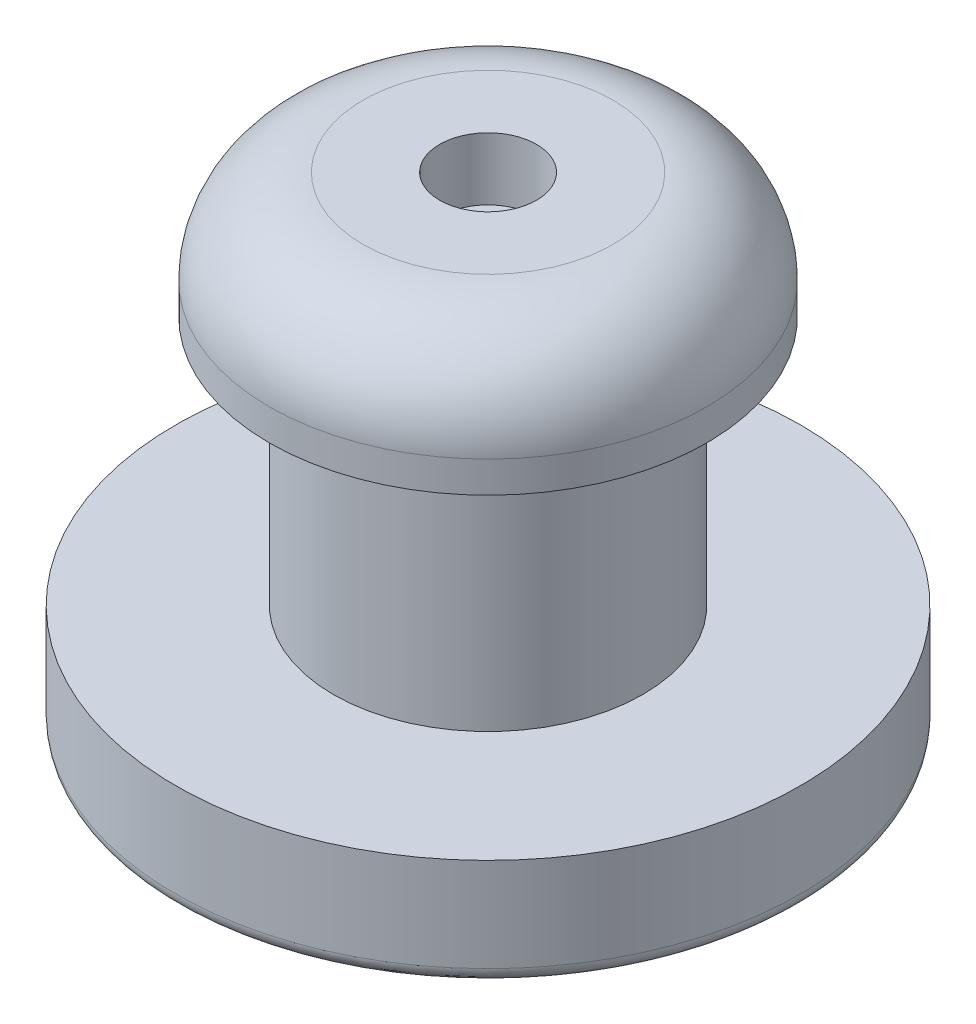
from build123d import *

# Parameters (mm, degrees)
SKETCH1_R           = 4.95
BOSS_EXTRUDE1_DEPTH = 9
SKETCH2_R           = 10
BOSS_EXTRUDE2_DEPTH = 3.5
SKETCH3_R           = 9
CUT_EXTRUDE1_DEPTH  = 1.5
SKETCH4_R           = 1.55
CUT_EXTRUDE2_DEPTH  = 19.874586088
CUT_EXTRUDE3_DEPTH  = 2.5
FILLET1_R           = 0.5
SKETCH6_R           = 7
SKETCH6_R_2         = 5.05
BOSS_EXTRUDE3_DEPTH = 2
SKETCH7_R           = 7
BOSS_EXTRUDE4_DEPTH = 2
SKETCH8_R           = 1.55
CUT_EXTRUDE4_DEPTH  = 21.98213538
FILLET2_R           = 3


with BuildPart() as part:
    # Sketch1 → Boss-Extrude1 (new body)
    with BuildSketch(Plane(origin=(0, 0, 0), x_dir=(1, 0, 0), z_dir=(0, 1, 0))):
        with Locations(Location((0, 0, 0), (0, 0, 270))):
            Circle(SKETCH1_R)
    extrude(amount=BOSS_EXTRUDE1_DEPTH)

    # Sketch2 → Boss-Extrude2 (add)
    with BuildSketch(Plane.XZ):
        with Locations(Location((0, 0, 0), (0, 0, 270))):
            Circle(SKETCH2_R)
    extrude(amount=BOSS_EXTRUDE2_DEPTH)

    # Sketch3 → Cut-Extrude1 (cut)
    with BuildSketch(Plane.XZ.offset(3.5)):
        with Locations(Location((0, 0, 0), (0, 0, 270))):
            Circle(SKETCH3_R)
    extrude(amount=-CUT_EXTRUDE1_DEPTH, mode=Mode.SUBTRACT)

    # Sketch4 → Cut-Extrude2 (cut, through all)
    with BuildSketch(Plane(origin=(0, 9, 0), x_dir=(1, 0, 0), z_dir=(0, 1, 0))):
        with Locations(Location((0, 0, 0), (0, 0, 270))):
            Circle(SKETCH4_R)
    extrude(amount=-CUT_EXTRUDE2_DEPTH, mode=Mode.SUBTRACT)

    # Sketch5 → Cut-Extrude3 (cut)
    with BuildSketch(Plane.XZ.offset(2)):
        Polygon((1.703183294, 2.95), (-1.703183294, 2.95), (-3.406366588, 0), (-1.703183294, -2.95), (1.703183294, -2.95), (3.406366588, 0), align=None)
    extrude(amount=-CUT_EXTRUDE3_DEPTH, mode=Mode.SUBTRACT)

    # Fillet1
    fillet1_edges = [part.edges().sort_by_distance(p)[0] for p in [
        (0, -3.5, 10),
    ]]
    fillet(fillet1_edges, radius=FILLET1_R)


with BuildPart() as body_2:
    # Sketch6 → Boss-Extrude3 (new body)
    with BuildSketch(Plane(origin=(0, 8, 0), x_dir=(1, 0, 0), z_dir=(0, 1, 0))):
        with Locations(Location((0, 0, 0), (0, 0, 270))):
            Circle(SKETCH6_R)
        with Locations(Location((0, 0, 0), (0, 0, 270))):
            Circle(SKETCH6_R_2, mode=Mode.SUBTRACT)
    extrude(amount=BOSS_EXTRUDE3_DEPTH)

    # Sketch7 → Boss-Extrude4 (add)
    with BuildSketch(Plane(origin=(0, 10, 0), x_dir=(1, 0, 0), z_dir=(0, 1, 0))):
        with Locations(Location((0, 0, 0), (0, 0, 270))):
            Circle(SKETCH7_R)
    extrude(amount=BOSS_EXTRUDE4_DEPTH)

    # Sketch8 → Cut-Extrude4 (cut, through all)
    with BuildSketch(Plane(origin=(0, 12, 0), x_dir=(1, 0, 0), z_dir=(0, 1, 0))):
        with Locations(Location((0, 0, 0), (0, 0, 270))):
            Circle(SKETCH8_R)
    extrude(amount=-CUT_EXTRUDE4_DEPTH, mode=Mode.SUBTRACT)

    # Fillet2
    fillet2_edges = [body_2.edges().sort_by_distance(p)[0] for p in [
        (0, 12, -7),
    ]]
    fillet(fillet2_edges, radius=FILLET2_R)


solid = Compound([part.part, body_2.part])
